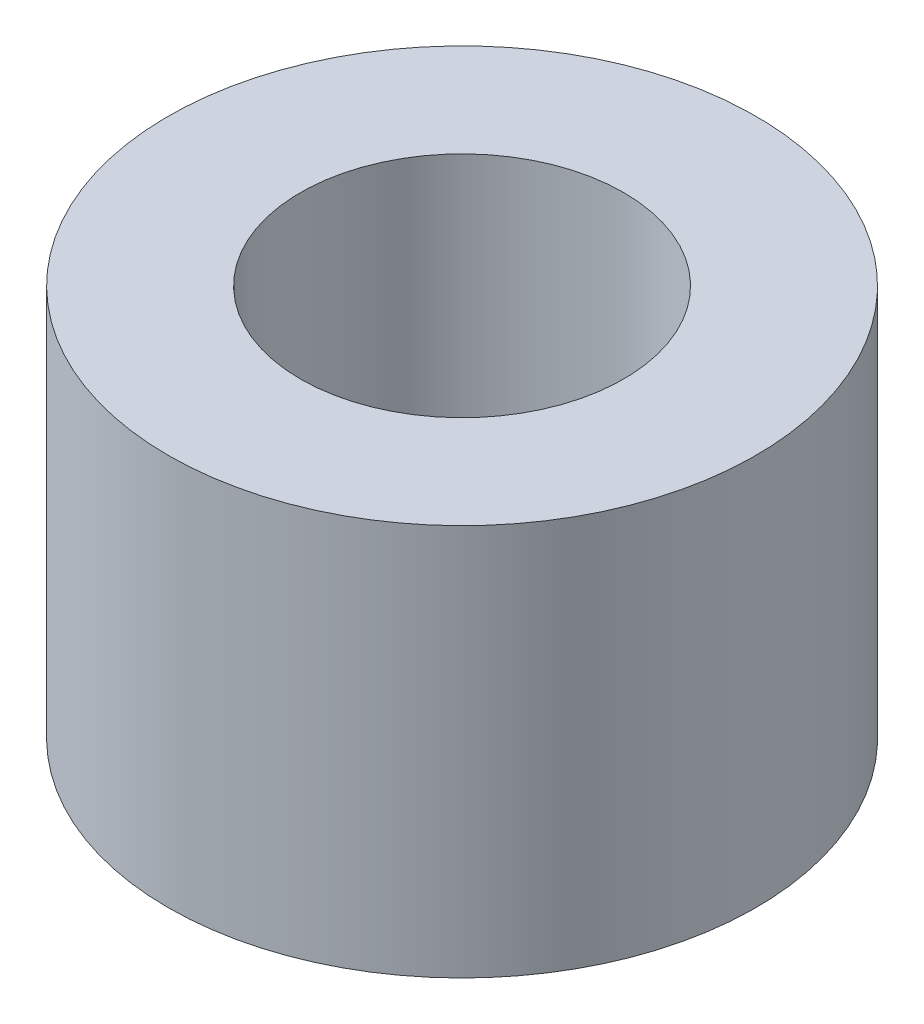
from build123d import *

# Parameters (mm, degrees)
SKETCH1_R             = 3
BOSS_EXTRUDE1_DEPTH   = 4
M4X0_7_TAPPED_HOLE1_D = 3.3


with BuildPart() as part:
    # Sketch1 → Boss-Extrude1 (new body)
    with BuildSketch(Plane(origin=(0, 0, 0), x_dir=(1, 0, 0), z_dir=(0, 1, 0))):
        with Locations(Location((0, 0, 0), (0, 0, 270))):
            Circle(SKETCH1_R)
    extrude(amount=BOSS_EXTRUDE1_DEPTH)

    # M4x0.7 Tapped Hole1 (through all)
    with Locations(Plane(origin=(0, 4, 0), x_dir=(1, 0, 0), z_dir=(0, 1, 0))):
        with Locations((0, 0)):
            Hole(M4X0_7_TAPPED_HOLE1_D / 2)


solid = part.part
